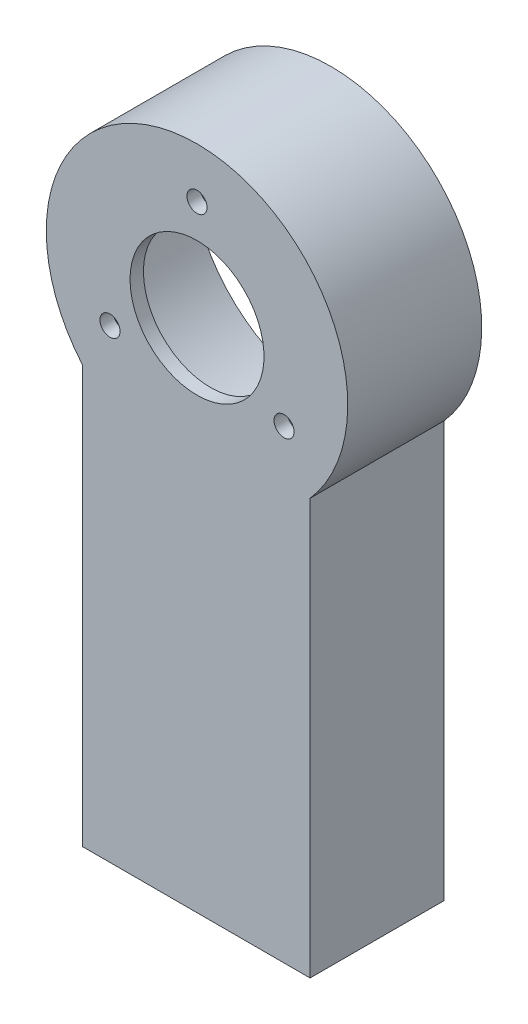
from build123d import *

# Parameters (mm, degrees)
SKETCH1_R           = 22.5
BOSS_EXTRUDE1_DEPTH = 20
SKETCH2_R           = 10
CUT_EXTRUDE1_DEPTH  = 20
SKETCH3_R           = 1.5
CUT_EXTRUDE2_DEPTH  = 20
SKETCH4_R           = 21
CUT_EXTRUDE3_DEPTH  = 18


with BuildPart() as part:
    # Sketch1 → Boss-Extrude1 (new body)
    with BuildSketch(Plane.XY):
        Circle(SKETCH1_R)
        with BuildLine():
            Line((-17.123625514, -14.595596913), (-17.123625514, -76.9))
            Line((-17.123625514, -76.9), (16.876374486, -76.9))
            Line((16.876374486, -76.9), (16.876374486, -14.880792459))
            ThreePointArc((16.876374486, -14.880792459), (-0.188725707, -22.499208488), (-17.123625514, -14.595596913))
        make_face()
    extrude(amount=BOSS_EXTRUDE1_DEPTH)

    # Sketch2 → Cut-Extrude1 (cut)
    with BuildSketch(Plane(origin=(0, 0, 0), x_dir=(-1, 0, 0), z_dir=(0, 0, -1))):
        Circle(SKETCH2_R)
    extrude(amount=-CUT_EXTRUDE1_DEPTH, mode=Mode.SUBTRACT)

    # Sketch3 → Cut-Extrude2 (cut)
    with BuildSketch(Plane(origin=(0, 0, 0), x_dir=(-1, 0, 0), z_dir=(0, 0, -1))):
        with Locations((0, 15)):
            Circle(SKETCH3_R)
        with Locations((12.990381057, -7.5)):
            Circle(SKETCH3_R)
        with Locations((-12.990381057, -7.5)):
            Circle(SKETCH3_R)
    extrude(amount=-CUT_EXTRUDE2_DEPTH, mode=Mode.SUBTRACT)

    # Sketch4 → Cut-Extrude3 (cut)
    with BuildSketch(Plane(origin=(0, 0, 0), x_dir=(-1, 0, 0), z_dir=(0, 0, -1))):
        Circle(SKETCH4_R)
    extrude(amount=-CUT_EXTRUDE3_DEPTH, mode=Mode.SUBTRACT)


solid = part.part
